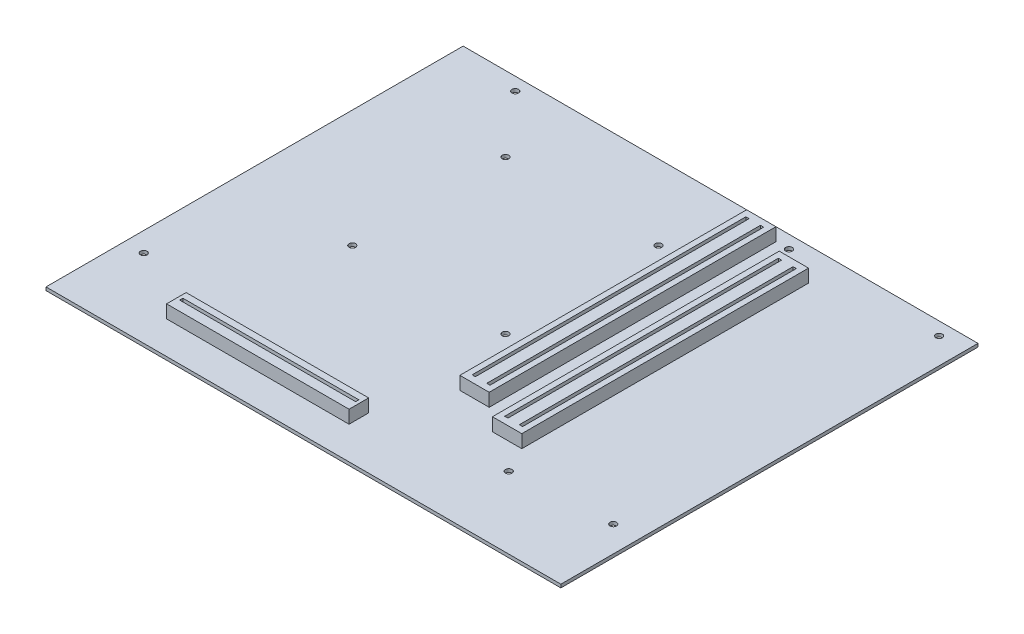
from build123d import *

# Parameters (mm, degrees)
SKETCH1_W           = 250.825
SKETCH1_H           = 203.2
SKETCH1_R           = 1.5875
BOSS_EXTRUDE1_DEPTH = 1.5875
SKETCH2_W           = 14.2875
SKETCH2_H           = 139.7
SKETCH2_W_2         = 1.5875
SKETCH2_H_2         = 133.35
SKETCH2_W_3         = 88.9
SKETCH2_H_3         = 9.525
SKETCH2_W_4         = 85.725
SKETCH2_H_4         = 1.5875
BOSS_EXTRUDE2_DEPTH = 6.35


with BuildPart() as part:
    # Sketch1 → Boss-Extrude1 (new body)
    with BuildSketch(Plane(origin=(0, 0, 0), x_dir=(1, 0, 0), z_dir=(0, 1, 0))):
        with Locations((125.4125, 101.6)):
            Rectangle(SKETCH1_W, SKETCH1_H)
        with Locations(Location((31.75, 196.85, 0), (0, 0, 270))):
            Circle(SKETCH1_R, mode=Mode.SUBTRACT)
        with Locations(Location((165.1, 196.85, 0), (0, 0, 270))):
            Circle(SKETCH1_R, mode=Mode.SUBTRACT)
        with Locations(Location((238.252, 196.85, 0), (0, 0, 270))):
            Circle(SKETCH1_R, mode=Mode.SUBTRACT)
        with Locations(Location((238.252, 38.1, 0), (0, 0, 270))):
            Circle(SKETCH1_R, mode=Mode.SUBTRACT)
        with Locations(Location((190.5, 34.925, 0), (0, 0, 270))):
            Circle(SKETCH1_R, mode=Mode.SUBTRACT)
        with Locations(Location((9.525, 38.1, 0), (0, 0, 270))):
            Circle(SKETCH1_R, mode=Mode.SUBTRACT)
        with Locations(Location((57.15, 166.6875, 0), (0, 0, 270))):
            Circle(SKETCH1_R, mode=Mode.SUBTRACT)
        with Locations(Location((131.7625, 166.6875, 0), (0, 0, 270))):
            Circle(SKETCH1_R, mode=Mode.SUBTRACT)
        with Locations(Location((131.7625, 92.075, 0), (0, 0, 270))):
            Circle(SKETCH1_R, mode=Mode.SUBTRACT)
        with Locations(Location((57.15, 92.075, 0), (0, 0, 270))):
            Circle(SKETCH1_R, mode=Mode.SUBTRACT)
    extrude(amount=BOSS_EXTRUDE1_DEPTH)

    # Sketch2 → Boss-Extrude2 (add)
    # profile 1 of 3: a face of its own
    with BuildSketch(Plane(origin=(0, 1.5875, 0), x_dir=(1, 0, 0), z_dir=(0, 1, 0))):
        with Locations((151.60625, 127)):
            Rectangle(SKETCH2_W, SKETCH2_H)
        with Locations((148.034375, 127)):
            Rectangle(SKETCH2_W_2, SKETCH2_H_2, mode=Mode.SUBTRACT)
        with Locations((155.178125, 127)):
            Rectangle(SKETCH2_W_2, SKETCH2_H_2, mode=Mode.SUBTRACT)
    # profile 2 of 3: a face of its own
    with BuildSketch(Plane(origin=(0, 1.5875, 0), x_dir=(1, 0, 0), z_dir=(0, 1, 0))):
        with Locations((177.00625, 117.475)):
            Rectangle(SKETCH2_W, SKETCH2_H)
        with Locations((173.434375, 117.475)):
            Rectangle(SKETCH2_W_2, SKETCH2_H_2, mode=Mode.SUBTRACT)
        with Locations((180.578125, 117.475)):
            Rectangle(SKETCH2_W_2, SKETCH2_H_2, mode=Mode.SUBTRACT)
    # profile 3 of 3: a face of its own
    with BuildSketch(Plane(origin=(0, 1.5875, 0), x_dir=(1, 0, 0), z_dir=(0, 1, 0))):
        with Locations((87.3125, 20.6375)):
            Rectangle(SKETCH2_W_3, SKETCH2_H_3)
        with Locations((87.3125, 21.43125)):
            Rectangle(SKETCH2_W_4, SKETCH2_H_4, mode=Mode.SUBTRACT)
    extrude(amount=BOSS_EXTRUDE2_DEPTH)


solid = part.part
